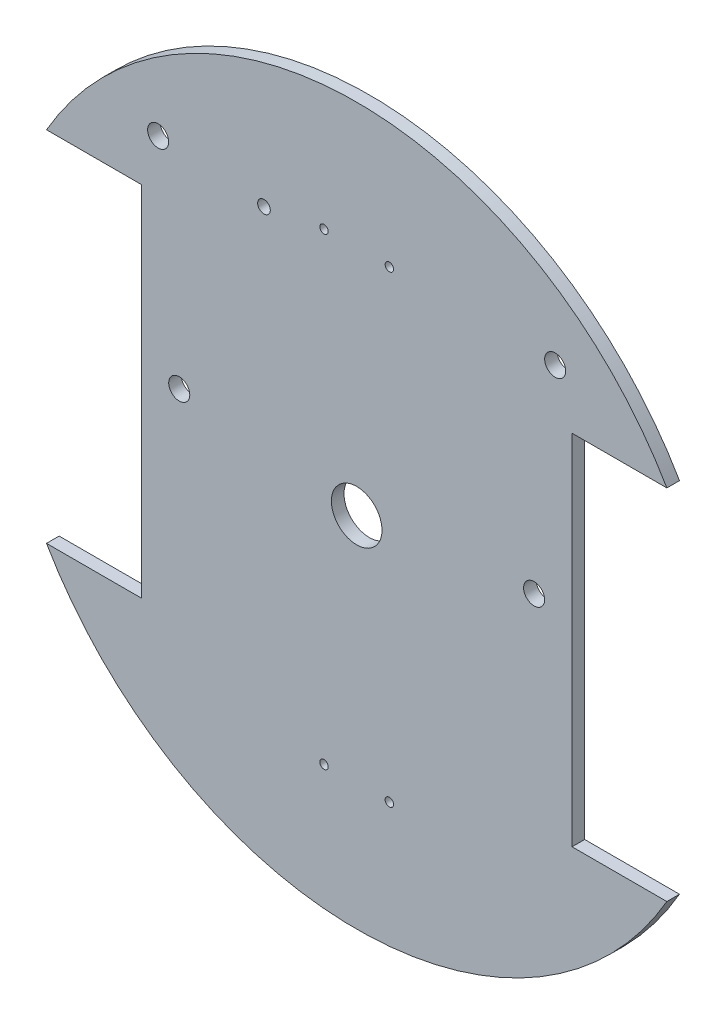
from build123d import *

# Parameters (mm, degrees)
ESQUISSE1_R              = 85
BOSS_EXTRU_1_DEPTH       = 3
ESQUISSE2_W              = 32.5
ESQUISSE2_H              = 85
ENL_V_MAT_EXTRU_6_DEPTH  = 3
ESQUISSE3_R              = 1
ENL_V_MAT_EXTRU_8_DEPTH  = 10
ESQUISSE53_R             = 2.5
ENL_V_MAT_EXTRU_21_DEPTH = 10
ESQUISSE54_R             = 2.5
ENL_V_MAT_EXTRU_22_DEPTH = 10
ESQUISSE55_R             = 1.5
ENL_V_MAT_EXTRU_23_DEPTH = 10
ESQUISSE56_R             = 6
ENL_V_MAT_EXTRU_24_DEPTH = 10


with BuildPart() as part:
    # Esquisse1 → Boss.-Extru.1 (new body)
    with BuildSketch(Plane.XY):
        with Locations((-147.95974357, 62.548931244)):
            Circle(ESQUISSE1_R)
    extrude(amount=BOSS_EXTRU_1_DEPTH)

    # Esquisse2 → Enlèv. mat.-Extru.6 (cut)
    with BuildSketch(Plane.XY):
        with BuildLine():
            Line((-199.071902892, 105.048931244), (-221.571902892, 105.048931244))
            ThreePointArc((-221.571902892, 105.048931244), (-227.739869981, 91.876928617), (-231.571902892, 77.846212492))
            Line((-231.571902892, 77.846212492), (-231.571902892, 47.251649997))
            ThreePointArc((-231.571902892, 47.251649997), (-227.739869981, 33.220933871), (-221.571902892, 20.048931244))
            Line((-221.571902892, 20.048931244), (-199.071902892, 20.048931244))
            Line((-199.071902892, 20.048931244), (-199.071902892, 105.048931244))
        make_face()
        with Locations((-80.597584249, 62.548931244)):
            Rectangle(ESQUISSE2_W, ESQUISSE2_H)
    extrude(amount=ENL_V_MAT_EXTRU_6_DEPTH, mode=Mode.SUBTRACT)


with BuildPart() as enl_v_mat_extru_6_piece_1:
    # of the separate pieces the step leaves, piece 1, a body of its own (enl_v_mat_extru_6_pieces)
    add(part.part.solids().sort_by_distance((-74.347584249, 105.048931244, 0))[0])

    # Esquisse3 → Enlèv. mat.-Extru.8 (cut)
    with BuildSketch(Plane.XY.offset(3)):
        with Locations((-155.70974357, 117.548931244)):
            Circle(ESQUISSE3_R)
        with Locations((-140.20974357, 117.548931244)):
            Circle(ESQUISSE3_R)
        with Locations((-140.20974357, 7.548931244)):
            Circle(ESQUISSE3_R)
        with Locations((-155.70974357, 7.548931244)):
            Circle(ESQUISSE3_R)
    extrude(amount=-ENL_V_MAT_EXTRU_8_DEPTH, mode=Mode.SUBTRACT)

    # Esquisse53 → Enlèv. mat.-Extru.21 (cut)
    with BuildSketch(Plane(origin=(0, 0, 0), x_dir=(-1, 0, 0), z_dir=(0, 0, -1))):
        with Locations((190.071902892, 67.548931244)):
            Circle(ESQUISSE53_R)
        with Locations((105.847584249, 67.548931244)):
            Circle(ESQUISSE53_R)
    extrude(amount=-ENL_V_MAT_EXTRU_21_DEPTH, mode=Mode.SUBTRACT)

    # Esquisse54 → Enlèv. mat.-Extru.22 (cut)
    with BuildSketch(Plane(origin=(0, 0, 0), x_dir=(-1, 0, 0), z_dir=(0, 0, -1))):
        with Locations((195.071902892, 117.048931244)):
            Circle(ESQUISSE54_R)
        with Locations(Location((100.847584249, 117.048931244, 0), (0, 0, 180))):
            Circle(ESQUISSE54_R)
    extrude(amount=-ENL_V_MAT_EXTRU_22_DEPTH, mode=Mode.SUBTRACT)

    # Esquisse55 → Enlèv. mat.-Extru.23 (cut)
    with BuildSketch(Plane(origin=(0, 0, 0), x_dir=(-1, 0, 0), z_dir=(0, 0, -1))):
        with Locations((169.95974357, 115.048931244)):
            Circle(ESQUISSE55_R)
    extrude(amount=-ENL_V_MAT_EXTRU_23_DEPTH, mode=Mode.SUBTRACT)

    # Esquisse56 → Enlèv. mat.-Extru.24 (cut)
    with BuildSketch(Plane(origin=(0, 0, 0), x_dir=(-1, 0, 0), z_dir=(0, 0, -1))):
        with Locations((147.95974357, 62.548931244)):
            Circle(ESQUISSE56_R)
    extrude(amount=-ENL_V_MAT_EXTRU_24_DEPTH, mode=Mode.SUBTRACT)


with BuildPart() as enl_v_mat_extru_6_piece_2:
    # of the separate pieces the step leaves, piece 2, a body of its own (enl_v_mat_extru_6_pieces)
    add(part.part.solids().sort_by_distance((-64.347584249, 47.251649997, 0))[0])


with BuildPart() as enl_v_mat_extru_6_piece_3:
    # of the separate pieces the step leaves, piece 3, a body of its own (enl_v_mat_extru_6_pieces)
    add(part.part.solids().sort_by_distance((-231.571902892, 77.846212492, 0))[0])


solid = enl_v_mat_extru_6_piece_1.part
